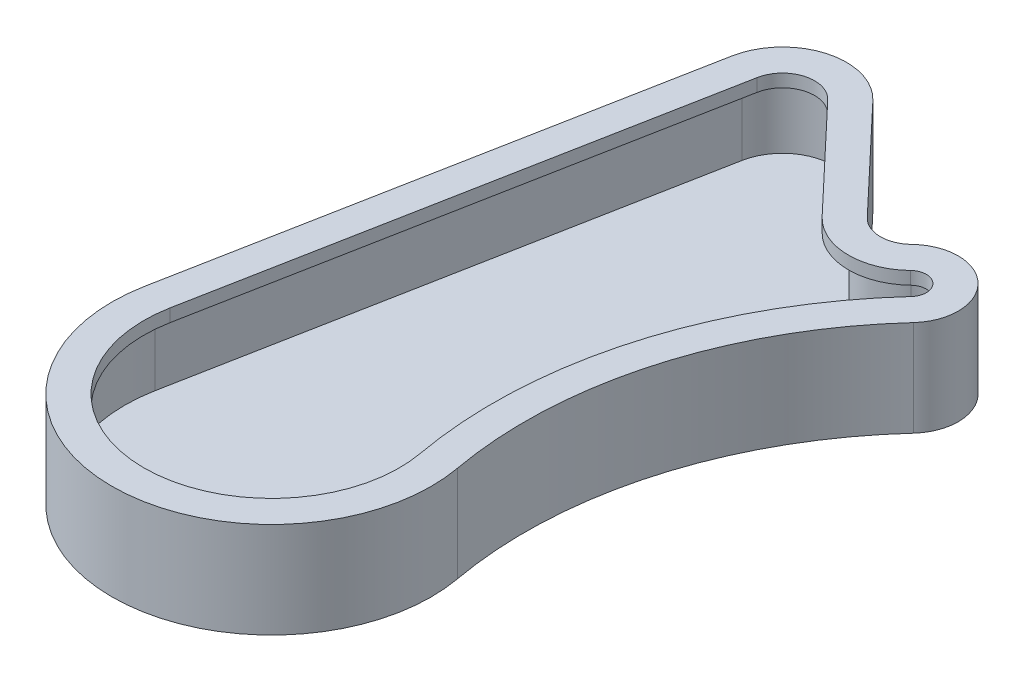
from build123d import *

# Parameters (mm, degrees)
BOSS_EXTRUDE1_DEPTH = 15
CUT_EXTRUDE1_DEPTH  = 13
BOSS_EXTRUDE2_START = -2
BOSS_EXTRUDE2_DEPTH = 2


with BuildPart() as part:
    # Sketch1 → Boss-Extrude1 (new body)
    with BuildSketch(Plane(origin=(0, 0, 0), x_dir=(1, 0, 0), z_dir=(0, 1, 0))):
        with BuildLine():
            Line((-24.556615071, 4.6875), (-9.822646028, 81.875))
            ThreePointArc((-9.822646028, 81.875), (-2.807110947, 89.597923116), (7.264280872, 86.872424857))
            Line((7.264280872, 86.872424857), (22.693183777, 70.563787572))
            ThreePointArc((22.693183777, 70.563787572), (26.210044162, 69.001329126), (29.795194528, 70.4))
            ThreePointArc((29.795194528, 70.4), (40.230934436, 70.374693007), (40.539091673, 59.943473184))
            ThreePointArc((40.539091673, 59.943473184), (26.07415519, 34.077117396), (24.595709122, 4.477844661))
            ThreePointArc((24.595709122, 4.477844661), (-0.106634546, -24.99977258), (-24.556615071, 4.6875))
        make_face()
    extrude(amount=BOSS_EXTRUDE1_DEPTH)

    # Sketch2 → Cut-Extrude1 (cut)
    with BuildSketch(Plane(origin=(0, 15, 0), x_dir=(1, 0, 0), z_dir=(0, 1, 0))):
        with BuildLine():
            Line((21.240327603, 69.1893026), (5.811424698, 85.497939885))
            ThreePointArc((5.811424698, 85.497939885), (-2.245688757, 87.678338492), (-7.858116823, 81.5))
            Line((-7.858116823, 81.5), (-22.592085865, 4.3125))
            ThreePointArc((-22.592085865, 4.3125), (-0.098103783, -22.999790774), (22.628052392, 4.119617088))
            ThreePointArc((22.628052392, 4.119617088), (24.151989109, 34.629636676), (39.06200056, 61.291880335))
            ThreePointArc((39.06200056, 61.291880335), (38.836018587, 68.941441539), (31.183142654, 68.96))
            ThreePointArc((31.183142654, 68.96), (26.163932142, 67.001860776), (21.240327603, 69.1893026))
        make_face()
    extrude(amount=-CUT_EXTRUDE1_DEPTH, mode=Mode.SUBTRACT)

    # Sketch7 → Boss-Extrude2 (add)
    with BuildSketch(Plane(origin=(0, 15, 0), x_dir=(1, 0, 0), z_dir=(0, 1, 0)).offset(BOSS_EXTRUDE2_START)):
        with BuildLine():
            Line((22.693183777, 70.563787572), (7.264280872, 86.872424857))
            ThreePointArc((7.264280872, 86.872424857), (-2.807110947, 89.597923116), (-9.822646028, 81.875))
            Line((-9.822646028, 81.875), (-24.556615071, 4.6875))
            ThreePointArc((-24.556615071, 4.6875), (-0.106634546, -24.99977258), (24.595709122, 4.477844661))
            ThreePointArc((24.595709122, 4.477844661), (26.07415519, 34.077117396), (40.539091673, 59.943473184))
            ThreePointArc((40.539091673, 59.943473184), (40.230934436, 70.374693007), (29.795194528, 70.4))
            ThreePointArc((29.795194528, 70.4), (26.210044162, 69.001329126), (22.693183777, 70.563787572))
        make_face()
        with BuildLine():
            Line((-4.911323014, 80.9375), (-19.645292057, 3.75))
            ThreePointArc((-19.645292057, 3.75), (-0.085307637, -19.999818064), (19.676567297, 3.582275729))
            ThreePointArc((19.676567297, 3.582275729), (21.268739987, 35.458415597), (36.846363891, 63.314491061))
            ThreePointArc((36.846363891, 63.314491061), (36.743644812, 66.791564336), (33.265064843, 66.8))
            ThreePointArc((33.265064843, 66.8), (26.094764111, 64.002658251), (19.061043341, 67.127575143))
            Line((19.061043341, 67.127575143), (3.632140436, 83.436212428))
            ThreePointArc((3.632140436, 83.436212428), (-1.403555473, 84.798961558), (-4.911323014, 80.9375))
        make_face(mode=Mode.SUBTRACT)
    extrude(amount=BOSS_EXTRUDE2_DEPTH)


solid = part.part
